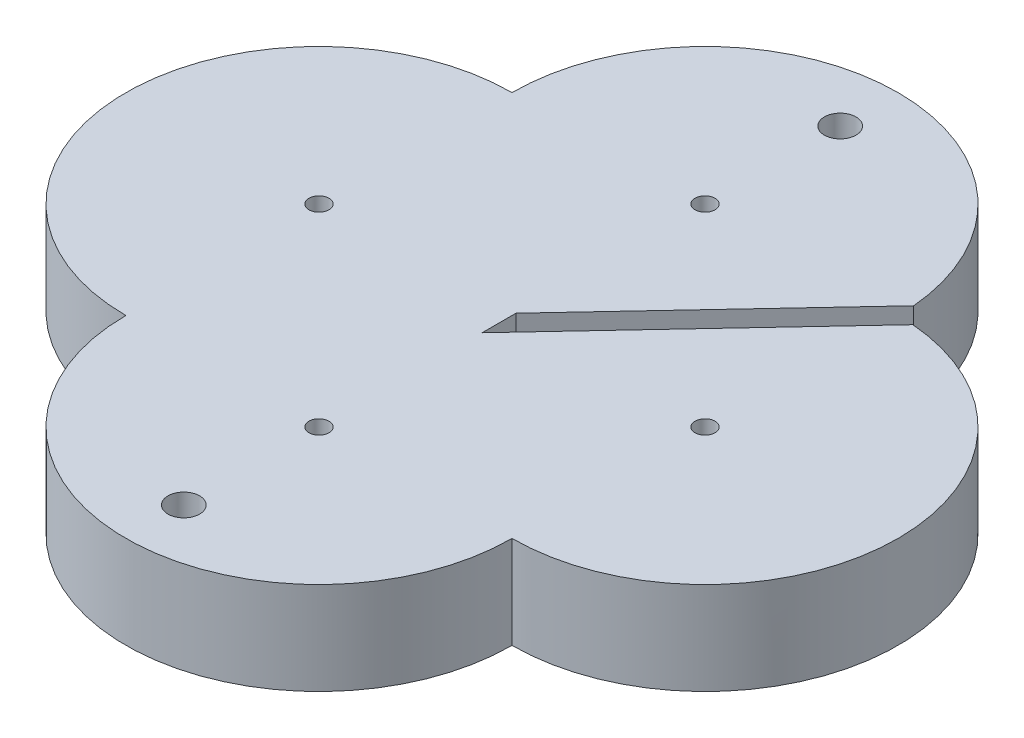
from build123d import *

# Parameters (mm, degrees)
IZIM1_R                              = 9.5
IZIM1_R_2                            = 4
IZIM1_W                              = 70
IZIM1_H                              = 70
Y_KSEKLIK_EKSTR_ZYON1_DEPTH          = 12
Y_KSEKLIK_EKSTR_ZYON2_DEPTH          = 12
KES_EKSTR_ZYON1_START                = -12
KES_EKSTR_ZYON1_DEPTH                = 12
IZIM6_R                              = 4
KES_EKSTR_ZYON4_DEPTH                = 20
M5_HELISARMAL_I_IN_Z_VANA_MATKAB_1_D = 5.2
IZIM9_R                              = 4.1
KES_EKSTR_ZYON5_DEPTH                = 50


with BuildPart() as part:
    # Çizim1 → Yükseklik-Ekstrüzyon1 (new body)
    with BuildSketch(Plane(origin=(0, 0, 0), x_dir=(1, 0, 0), z_dir=(0, 1, 0))):
        with BuildLine():
            ThreePointArc((19.545454545, 40.340909091), (-30.454545455, 90.340909091), (-80.454545455, 40.340909091))
            ThreePointArc((-80.454545455, 40.340909091), (-130.454545455, -9.659090909), (-80.454545455, -59.659090909))
            ThreePointArc((-80.454545455, -59.659090909), (-30.454545455, -109.659090909), (19.545454545, -59.659090909))
            ThreePointArc((19.545454545, -59.659090909), (69.545454545, -9.659090909), (19.545454545, 40.340909091))
        make_face()
        with Locations(Location((-30.454545455, -94.659090909, 0), (0, 0, 270))):
            Circle(IZIM1_R, mode=Mode.SUBTRACT)
        with Locations(Location((-30.454545455, 75.340909091, 0), (0, 0, 270))):
            Circle(IZIM1_R, mode=Mode.SUBTRACT)
        with Locations(Location((54.545454545, -9.659090909, 0), (0, 0, 270))):
            Circle(IZIM1_R_2, mode=Mode.SUBTRACT)
        with Locations(Location((-115.454545455, -9.659090909, 0), (0, 0, 270))):
            Circle(IZIM1_R_2, mode=Mode.SUBTRACT)
        with Locations((-30.454545455, -9.659090909)):
            Rectangle(IZIM1_W, IZIM1_H, mode=Mode.SUBTRACT)
    extrude(amount=Y_KSEKLIK_EKSTR_ZYON1_DEPTH)

    # Çizim2 → Yükseklik-Ekstrüzyon2 (add)
    with BuildSketch(Plane(origin=(0, 12, 0), x_dir=(1, 0, 0), z_dir=(0, 1, 0))):
        with BuildLine():
            ThreePointArc((19.545454545, 40.340909091), (-30.454545455, 90.340909091), (-80.454545455, 40.340909091))
            ThreePointArc((-80.454545455, 40.340909091), (-130.454545455, -9.659090909), (-80.454545455, -59.659090909))
            ThreePointArc((-80.454545455, -59.659090909), (-30.454545455, -109.659090909), (19.545454545, -59.659090909))
            ThreePointArc((19.545454545, -59.659090909), (69.545454545, -9.659090909), (19.545454545, 40.340909091))
        make_face()
    extrude(amount=Y_KSEKLIK_EKSTR_ZYON2_DEPTH)

    # Çizim3 → Kes-Ekstrüzyon1 (cut)
    with BuildSketch(Plane(origin=(0, 24, 0), x_dir=(1, 0, 0), z_dir=(0, 1, 0)).offset(KES_EKSTR_ZYON1_START)):
        with BuildLine():
            Line((-30.454545455, -8.628204493), (-30.454545455, -17.402914961))
            Line((-30.454545455, -17.402914961), (23.509344434, 40.183537201))
            ThreePointArc((23.509344434, 40.183537201), (21.528960845, 40.301550628), (19.545454545, 40.340909091))
            ThreePointArc((19.545454545, 40.340909091), (19.501280543, 42.442206057), (19.368836588, 44.539790114))
            Line((19.368836588, 44.539790114), (-30.454545455, -8.628204493))
        make_face()
    extrude(amount=KES_EKSTR_ZYON1_DEPTH, mode=Mode.SUBTRACT)

    # Çizim6 → Kes-Ekstrüzyon4 (cut)
    with BuildSketch(Plane.XZ):
        with Locations(Location((-115.454545455, 9.659090909, 0), (0, 0, 270))):
            Circle(IZIM6_R)
        with Locations(Location((54.545454545, 9.659090909, 0), (0, 0, 270))):
            Circle(IZIM6_R)
    extrude(amount=-KES_EKSTR_ZYON4_DEPTH, mode=Mode.SUBTRACT)

    # M5 Helisarmal için Zıvana matkabı1 (through all)
    with Locations(Plane(origin=(-80.454545455, 0, 9.659090909), x_dir=(0, 0, -1), z_dir=(0, -1, 0))):
        with Locations((0, 0), (-50, 50), (0, 100), (50, 50)):
            Hole(M5_HELISARMAL_I_IN_Z_VANA_MATKAB_1_D / 2)

    # Çizim9 → Kes-Ekstrüzyon5 (cut)
    with BuildSketch(Plane.XZ):
        with Locations(Location((-30.454545455, 94.659090909, 0), (0, 0, 90))):
            Circle(IZIM9_R)
        with Locations(Location((-30.454545455, -75.340909091, 0), (0, 0, 90))):
            Circle(IZIM9_R)
    extrude(amount=-KES_EKSTR_ZYON5_DEPTH, mode=Mode.SUBTRACT)


solid = part.part
